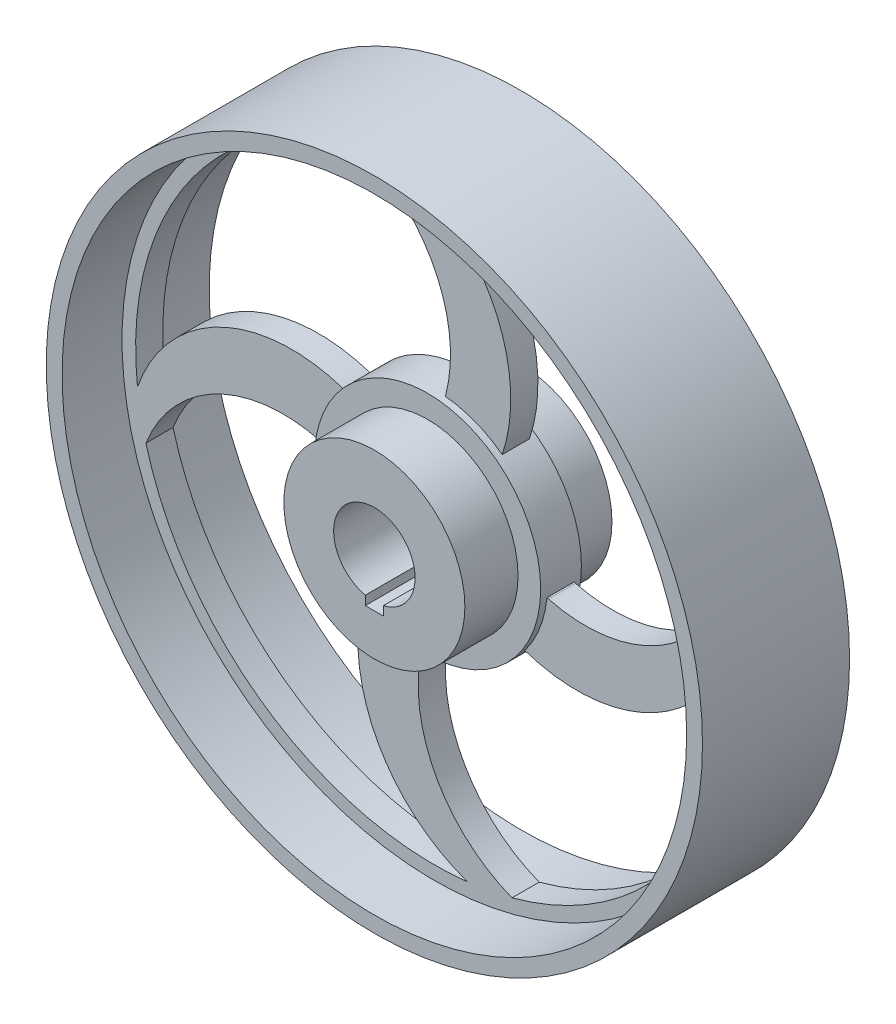
from build123d import *

# Parameters (mm, degrees)
SKETCH4_R            = 1270
BOSS_EXTRUDE2_DEPTH  = 228.6
SKETCH5_R            = 1016
BOSS_EXTRUDE3_DEPTH  = 825.5
CUT_EXTRUDE2_DEPTH   = 825.5
SKETCH7_R            = 3505.2
SKETCH7_R_2          = 3352.8
BOSS_EXTRUDE5_DEPTH  = 152.4
SKETCH9_R            = 3683
SKETCH9_R_2          = 3505.2
BOSS_EXTRUDE8_DEPTH  = 825.5
BOSS_EXTRUDE10_DEPTH = 152.4


with BuildPart() as part:
    # Sketch4 → Boss-Extrude2 (new, symmetric)
    with BuildSketch(Plane.XY):
        Circle(SKETCH4_R)
    extrude(amount=BOSS_EXTRUDE2_DEPTH, both=True)

    # Sketch5 → Boss-Extrude3 (add, symmetric)
    with BuildSketch(Plane.XY):
        Circle(SKETCH5_R)
    extrude(amount=BOSS_EXTRUDE3_DEPTH, both=True)

    # Sketch6 → Cut-Extrude2 (cut, symmetric)
    with BuildSketch(Plane.XY):
        with BuildLine():
            Line((101.6, -547.36819088), (-101.6, -547.36819088))
            Line((-101.6, -547.36819088), (-101.6, -445.76819088))
            ThreePointArc((-101.6, -445.76819088), (0, 457.2), (101.6, -445.76819088))
            Line((101.6, -445.76819088), (101.6, -547.36819088))
        make_face()
    extrude(amount=CUT_EXTRUDE2_DEPTH, both=True, mode=Mode.SUBTRACT)



with BuildPart() as body_2:
    # Sketch7 → Boss-Extrude5 (new, symmetric)
    with BuildSketch(Plane.XY):
        with Locations(Location((0, 0, 0), (0, 0, 180))):
            Circle(SKETCH7_R)
        with Locations(Location((0, 0, 0), (0, 0, 180))):
            Circle(SKETCH7_R_2, mode=Mode.SUBTRACT)
    extrude(amount=BOSS_EXTRUDE5_DEPTH, both=True)

    # Sketch9 → Boss-Extrude8 (add, symmetric)
    with BuildSketch(Plane.XY):
        Circle(SKETCH9_R)
        Circle(SKETCH9_R_2, mode=Mode.SUBTRACT)
    extrude(amount=BOSS_EXTRUDE8_DEPTH, both=True)


with BuildPart() as part_1:
    add(part.part)

    add(body_2.part)  # Boss-Extrude10 merges body 2
    # Sketch10 → Boss-Extrude10 (add, symmetric)
    with BuildSketch(Plane.XY):
        with BuildLine():
            Line((128.323732845, 1280.530953966), (124.019045377, 1263.930091573))
            ThreePointArc((124.019045377, 1263.930091573), (460.026922875, 1183.754717089), (762, 1016))
            ThreePointArc((762, 1016), (671.019226754, 2407.545178719), (-373.05648294, 3331.980897385))
            ThreePointArc((-373.05648294, 3331.980897385), (-624.407212979, 3294.143814769), (-872.169182147, 3237.373743903))
            ThreePointArc((-872.169182147, 3237.373743903), (-0.09284249, 2449.061214398), (128.323732845, 1280.530953966))
        make_face()
        with BuildLine():
            Line((1280.530953966, -128.323732845), (1263.930091573, -124.019045377))
            ThreePointArc((1263.930091573, -124.019045377), (1183.754717089, -460.026922875), (1016, -762))
            ThreePointArc((1016, -762), (2407.545178719, -671.019226754), (3331.980897385, 373.05648294))
            ThreePointArc((3331.980897385, 373.05648294), (3294.143814769, 624.407212979), (3237.373743903, 872.169182147))
            ThreePointArc((3237.373743903, 872.169182147), (2449.061214398, 0.09284249), (1280.530953966, -128.323732845))
        make_face()
        with BuildLine():
            Line((-128.323732845, -1280.530953966), (-124.019045377, -1263.930091573))
            ThreePointArc((-124.019045377, -1263.930091573), (-460.026922875, -1183.754717089), (-762, -1016))
            ThreePointArc((-762, -1016), (-671.019226754, -2407.545178719), (373.05648294, -3331.980897385))
            ThreePointArc((373.05648294, -3331.980897385), (624.407212979, -3294.143814769), (872.169182147, -3237.373743903))
            ThreePointArc((872.169182147, -3237.373743903), (0.09284249, -2449.061214398), (-128.323732845, -1280.530953966))
        make_face()
        with BuildLine():
            Line((-1280.530953966, 128.323732845), (-1263.930091573, 124.019045377))
            ThreePointArc((-1263.930091573, 124.019045377), (-1183.754717089, 460.026922875), (-1016, 762))
            ThreePointArc((-1016, 762), (-2407.545178719, 671.019226754), (-3331.980897385, -373.05648294))
            ThreePointArc((-3331.980897385, -373.05648294), (-3294.143814769, -624.407212979), (-3237.373743903, -872.169182147))
            ThreePointArc((-3237.373743903, -872.169182147), (-2449.061214398, -0.09284249), (-1280.530953966, 128.323732845))
        make_face()
    extrude(amount=BOSS_EXTRUDE10_DEPTH, both=True)


solid = part_1.part
